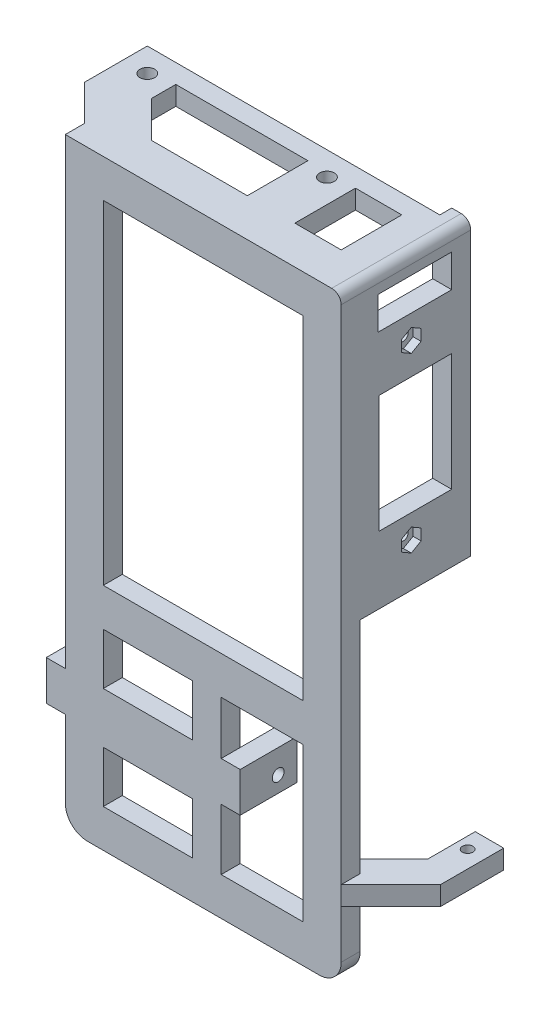
from build123d import *

# Parameters (mm, degrees)
EXTRUDE_5_DEPTH      = 4
SKETCH_5_W           = 65.55
SKETCH_5_H           = 20.755
SKETCH_5_R           = 1.55
EXTRUDE_6_DEPTH      = 4
SKETCH_7_W           = 65.55
SKETCH_7_H           = 126.45
EXTRUDE_8_DEPTH      = 4
SKETCH_11_W          = 17.25
SKETCH_11_H          = 32.3
SKETCH_11_W_2        = 18.8
SKETCH_11_H_2        = 10.8
CUT_EXTRUDE_3_DEPTH  = 125.085535116
EXTRUDE_9_DEPTH      = 4
CUT_EXTRUDE_4_DEPTH  = 10
SKETCH_14_W          = 9.75
SKETCH_14_H          = 12.755
CUT_EXTRUDE_5_DEPTH  = 10
SKETCH_16_W          = 15.255
SKETCH_16_H          = 24.75
SKETCH_16_W_2        = 15.505
SKETCH_16_H_2        = 6.88
CUT_EXTRUDE_6_DEPTH  = 133.101854737
EXTRUDE_2_DEPTH      = 4
CUT_EXTRUDE_7_REACH  = 127.39
SKETCH_19_R          = 1.1
SKETCH_21_W          = 4
SKETCH_21_H          = 2.5
EXTRUDE_11_DEPTH     = 4
FILLET_2_R           = 2
FILLET_3_R           = 4.65
SKETCH_24_R          = 1
CUT_EXTRUDE_10_DEPTH = 133.101854737
SKETCH_25_R          = 0.9
EXTRUDE_12_DEPTH     = 1
FILLET_4_R           = 0.8
CUT_EXTRUDE_11_DEPTH = 1.68


with BuildPart() as part:
    # 草图4 → 凸台-拉伸5 (new body)
    with BuildSketch(Plane(origin=(37.65, 0, 0), x_dir=(0, 0, -1), z_dir=(1, 0, 0))):
        Polygon((23.255, 110.55), (19.873443934, 110.55), (11.636556066, 110.55), (0, 110.55), (0, 53.1366), (23.255, 53.1366), align=None)
    extrude(amount=EXTRUDE_5_DEPTH)

    # 草图5 → 凸台-拉伸6 (add)
    with BuildSketch(Plane(origin=(0, 110.55, 0), x_dir=(1, 0, 0), z_dir=(0, 1, 0))):
        with Locations((8.875, 10.3775)):
            Rectangle(SKETCH_5_W, SKETCH_5_H)
        with Locations(Location((-18.9, 15.755, 0), (0, 0, 180))):
            Circle(SKETCH_5_R, mode=Mode.SUBTRACT)
        with Locations(Location((18.9, 15.755, 0), (0, 0, 180))):
            Circle(SKETCH_5_R, mode=Mode.SUBTRACT)
    extrude(amount=EXTRUDE_6_DEPTH)

    # 草图7 → 凸台-拉伸8 (add)
    with BuildSketch(Plane.XY):
        with Locations((8.875, 51.325)):
            Rectangle(SKETCH_7_W, SKETCH_7_H)
    extrude(amount=EXTRUDE_8_DEPTH)

    # 草图11 → 切除-拉伸3 (cut, through all)
    with BuildSketch(Plane(origin=(0, 0, 0), x_dir=(-1, 0, 0), z_dir=(0, 0, -1))):
        with Locations((-25.025, 12.25)):
            Rectangle(SKETCH_11_W, SKETCH_11_H)
        Polygon((-33.65, 106.55), (-33.65, 36.4), (-16.4, 36.4), (8.4, 36.4), (8.4, 106.55), align=None)
        with Locations((-1, 1.5)):
            Rectangle(SKETCH_11_W_2, SKETCH_11_H_2)
        with Locations((-1, 23)):
            Rectangle(SKETCH_11_W_2, SKETCH_11_H_2)
        with BuildLine():
            ThreePointArc((16.4, -7.25), (15.038046533, -10.538046533), (11.75, -11.9))
            Line((11.75, -11.9), (23.9, -11.9))
            Line((23.9, -11.9), (23.9, 106.55))
            Line((23.9, 106.55), (16.4, 106.55))
            Line((16.4, 106.55), (16.4, -7.25))
        make_face()
    extrude(amount=-CUT_EXTRUDE_3_DEPTH, mode=Mode.SUBTRACT)

    # 草图12 → 凸台-拉伸9 (add)
    with BuildSketch(Plane(origin=(0, 2.890336251, 0), x_dir=(1, 0, 0), z_dir=(0, 1, 0))):
        Polygon((52.095757056, 19.755), (46.095757056, 19.755), (46.095757056, 9.855), (36.240757056, 0), (41.65, -4), (52.095757056, 6.445757056), align=None)
    extrude(amount=EXTRUDE_9_DEPTH)

    # 草图13 → 切除-拉伸4 (cut, symmetric)
    with BuildSketch(Plane.XZ.offset(-110.55)):
        Polygon((-23.9, -7.5), (-16.4, 0), (-16.4, 4), (-23.9, 4), align=None)
    extrude(amount=CUT_EXTRUDE_4_DEPTH, both=True, mode=Mode.SUBTRACT)

    # 草图14 → 切除-拉伸5 (cut)
    with BuildSketch(Plane.XZ.offset(-110.55)):
        with Locations((28.775, -10.3775)):
            Rectangle(SKETCH_14_W, SKETCH_14_H)
        Polygon((13.9, -16.755), (-13.9, -16.755), (-13.9, -11.642135624), (-6.257864376, -4), (13.9, -4), align=None)
    extrude(amount=-CUT_EXTRUDE_5_DEPTH, mode=Mode.SUBTRACT)

    # 草图16 → 切除-拉伸6 (cut, through all)
    with BuildSketch(Plane.ZY.offset(-37.65)):
        with Locations((-11.6275, 79.675)):
            Rectangle(SKETCH_16_W, SKETCH_16_H)
        with Locations((-11.5025, 107.11)):
            Rectangle(SKETCH_16_W_2, SKETCH_16_H_2)
    extrude(amount=-CUT_EXTRUDE_6_DEPTH, mode=Mode.SUBTRACT)

    # 草图2 → 凸台-拉伸2 (add)
    with BuildSketch(Plane.ZY.offset(16.4)):
        Polygon((-8, 12.25), (-8, 8.9), (4, 8.9), (4, 17.25), (-8, 17.25), align=None)
        with BuildLine():
            ThreePointArc((-2.75, 12.25), (-4, 11), (-5.25, 12.25))
            ThreePointArc((-5.25, 12.25), (-4, 13.5), (-2.75, 12.25))
        make_face(mode=Mode.SUBTRACT)
    extrude_2 = extrude(amount=EXTRUDE_2_DEPTH)

    # 镜向10: 凸台-拉伸2 across plane
    add(extrude_2.mirror(Plane(origin=(0, 0, 0), x_dir=(0, 0, 1), z_dir=(1, 0, 0))))

    # 草图19 → 切除-拉伸7 (cut, up to next)
    with BuildSketch(Plane.XZ.offset(-2.890336251), mode=Mode.PRIVATE) as cut_extrude_7_sk1:
        with Locations((48.495757056, -15.755)):
            Circle(SKETCH_19_R)
    cut_extrude_7_tool1 = extrude(cut_extrude_7_sk1.sketch, amount=-CUT_EXTRUDE_7_REACH, mode=Mode.PRIVATE) & part.part
    add(cut_extrude_7_tool1.solids().sort_by_distance((48.495757, 2.890336, -15.755))[0], mode=Mode.SUBTRACT)

    # 草图21 → 凸台-拉伸11 (add)
    with BuildSketch(Plane(origin=(0, 110.55, 0), x_dir=(1, 0, 0), z_dir=(0, 1, 0))):
        with Locations((39.65, 22.005)):
            Rectangle(SKETCH_21_W, SKETCH_21_H)
    extrude(amount=EXTRUDE_11_DEPTH)

    # 圆角2
    fillet_2_edges = [part.edges().sort_by_distance(p)[0] for p in [
        (37.65, 110.55, -20.005),
        (41.65, 114.55, -9.6275),
        (37.65, 110.55, -1.875),
    ]]
    fillet(fillet_2_edges, radius=FILLET_2_R)

    # 圆角3
    fillet_3_edges = [part.edges().sort_by_distance(p)[0] for p in [
        (41.65, -11.9, 2),
    ]]
    fillet(fillet_3_edges, radius=FILLET_3_R)

    # 草图24 → 切除-拉伸10 (cut, through all)
    with BuildSketch(Plane.ZY.offset(-37.65)):
        with Locations(Location((-10.755, 62.3, 0), (0, 0, 270))):
            Circle(SKETCH_24_R)
        with Locations(Location((-10.755, 98.67, 0), (0, 0, 270))):
            Circle(SKETCH_24_R)
    extrude(amount=-CUT_EXTRUDE_10_DEPTH, mode=Mode.SUBTRACT)

    # 草图25 → 凸台-拉伸12 (add)
    with BuildSketch(Plane.ZY.offset(-37.65)):
        with Locations(Location((-10.755, 57.65, 0), (0, 0, 90))):
            Circle(SKETCH_25_R)
        with Locations(Location((-10.755, 94.05, 0), (0, 0, 90))):
            Circle(SKETCH_25_R)
    extrude(amount=EXTRUDE_12_DEPTH)

    # 圆角4
    fillet_4_edges = [part.edges().sort_by_distance(p)[0] for p in [
        (36.65, 93.15, -10.755),
        (36.65, 56.75, -10.755),
    ]]
    fillet(fillet_4_edges, radius=FILLET_4_R)

    # 草图27 → 切除-拉伸11 (cut)
    with BuildSketch(Plane(origin=(41.65, 0, 0), x_dir=(0, 0, -1), z_dir=(1, 0, 0))):
        Polygon((10.755, 96.302863896), (12.805, 97.486431948), (12.805, 99.853568052), (10.755, 101.037136104), (8.705, 99.853568052), (8.705, 97.486431948), align=None)
        Polygon((10.755, 59.932863896), (12.805, 61.116431948), (12.805, 63.483568052), (10.755, 64.667136104), (8.705, 63.483568052), (8.705, 61.116431948), align=None)
    extrude(amount=-CUT_EXTRUDE_11_DEPTH, mode=Mode.SUBTRACT)


solid = part.part
